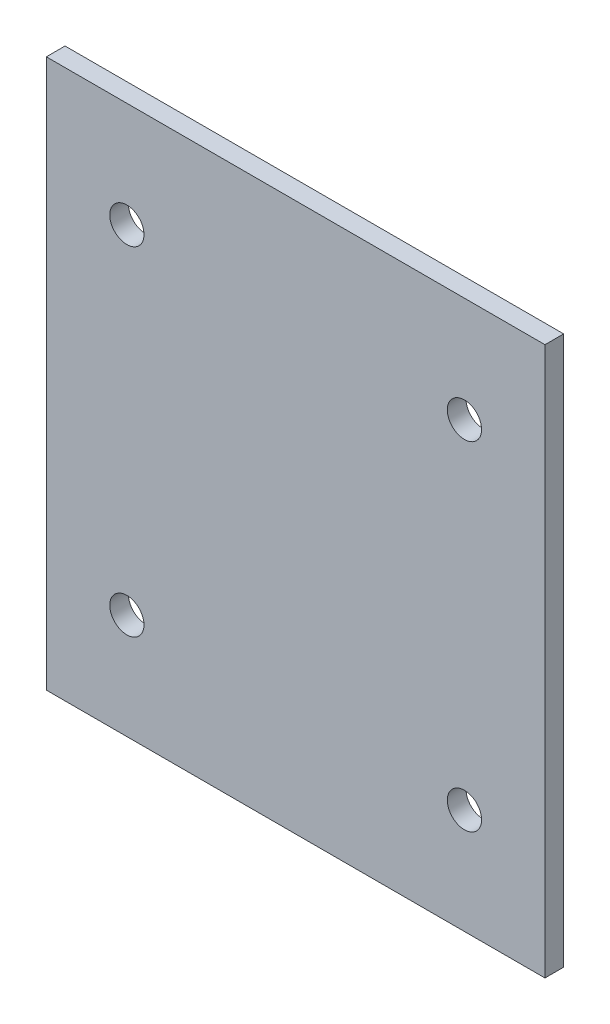
from build123d import *

# Parameters (mm, degrees)
SKETCH1_W               = 254
SKETCH1_H               = 279.4
BOSS_EXTRUDE1_DEPTH     = 9.525
F_5_8_CLEARANCE_HOLE1_D = 17.4498


with BuildPart() as part:
    # Sketch1 → Boss-Extrude1 (new body)
    with BuildSketch(Plane.XY):
        Rectangle(SKETCH1_W, SKETCH1_H)
    extrude(amount=BOSS_EXTRUDE1_DEPTH)

    # 5/8 Clearance Hole1 (through all)
    with Locations(Plane.XY.offset(9.525)):
        with Locations((-85.979, 86.106), (-85.979, -86.106), (85.979, -86.106), (85.979, 86.106)):
            Hole(F_5_8_CLEARANCE_HOLE1_D / 2)


solid = part.part
